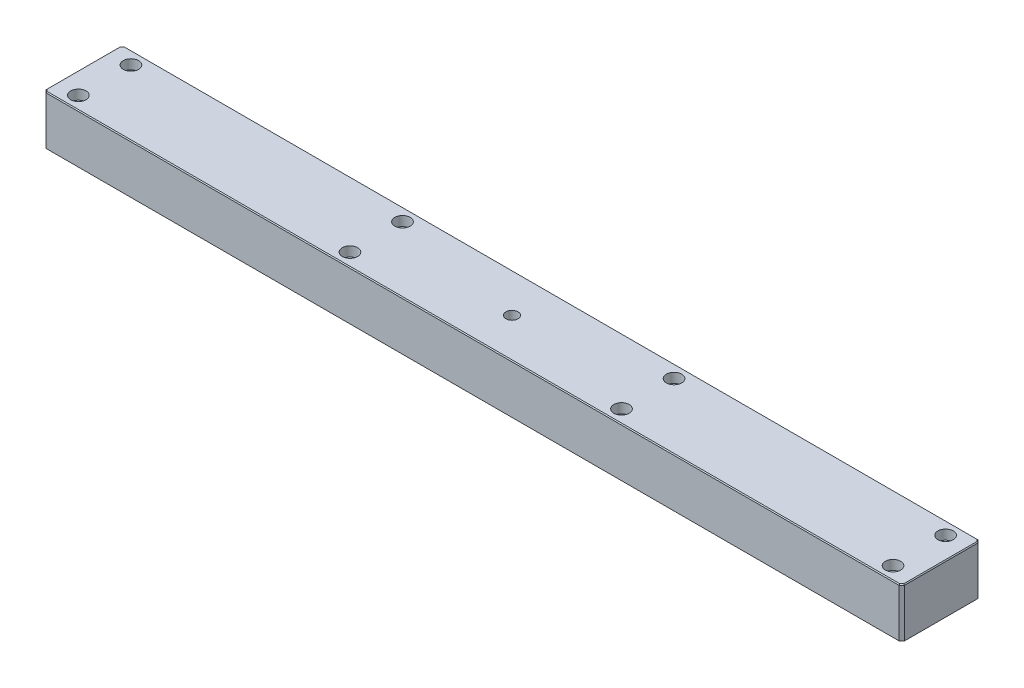
from build123d import *

# Parameters (mm, degrees)
SKETCH_1_W               = 980
SKETCH_1_H               = 90
EXTRUDE_1_DEPTH          = 56
CHAMFER_1_SIZE           = 3
CHAMFER_2_SIZE           = 1
CUT_EXTRUDE_1_DEPTH      = 496.238326465
CUT_EXTRUDE_1_DEPTH_BACK = 496.238326465
SKETCH_2_R               = 5.5
SKETCH_4_R               = 8.75
CUT_EXTRUDE_2_DEPTH      = 11
SKETCH_5_R               = 6.9175
CUT_EXTRUDE_3_DEPTH      = 25


with BuildPart() as part:
    # ｽｹｯﾁ1 → ﾎﾞｽ - 押し出し1 (new body)
    with BuildSketch(Plane(origin=(0, 0, 0), x_dir=(1, 0, 0), z_dir=(0, 1, 0))):
        Rectangle(SKETCH_1_W, SKETCH_1_H)
    extrude(amount=EXTRUDE_1_DEPTH)

    # 面取り1
    chamfer_1_edges = [part.edges().sort_by_distance(p)[0] for p in [
        (-490, 28, -45),
        (490, 28, -45),
        (490, 28, 45),
        (-490, 28, 45),
    ]]
    chamfer(chamfer_1_edges, length=CHAMFER_1_SIZE)

    # 面取り2
    chamfer_2_edges = [part.edges().sort_by_distance(p)[0] for p in [
        (-490, 56, 0),
        (0, 56, -45),
        (0, 56, 45),
        (490, 56, 0),
        (-488.5, 56, 43.5),
        (488.5, 56, 43.5),
        (488.5, 56, -43.5),
        (-488.5, 56, -43.5),
    ]]
    chamfer(chamfer_2_edges, length=CHAMFER_2_SIZE)

    # ｽｹｯﾁ2 → ｶｯﾄ - 押し出し1 (cut, two sides: drawn at the far end of the back side and taken through both)
    with BuildSketch(Plane(origin=(0, 0, 0), x_dir=(1, 0, 0), z_dir=(0, 1, 0)).offset(-CUT_EXTRUDE_1_DEPTH_BACK)):
        with Locations(Location((-155, -30, 0), (0, 0, 270))):
            Circle(SKETCH_2_R)
        with Locations(Location((-155, 30, 0), (0, 0, 270))):
            Circle(SKETCH_2_R)
        with Locations(Location((-465, -30, 0), (0, 0, 270))):
            Circle(SKETCH_2_R)
        with Locations(Location((-465, 30, 0), (0, 0, 270))):
            Circle(SKETCH_2_R)
        with Locations(Location((155, -30, 0), (0, 0, 270))):
            Circle(SKETCH_2_R)
        with Locations(Location((155, 30, 0), (0, 0, 270))):
            Circle(SKETCH_2_R)
        with Locations(Location((465, -30, 0), (0, 0, 270))):
            Circle(SKETCH_2_R)
        with Locations(Location((465, 30, 0), (0, 0, 270))):
            Circle(SKETCH_2_R)
    extrude(amount=CUT_EXTRUDE_1_DEPTH + CUT_EXTRUDE_1_DEPTH_BACK, mode=Mode.SUBTRACT)

    # ｽｹｯﾁ4 → ｶｯﾄ - 押し出し2 (cut)
    with BuildSketch(Plane(origin=(0, 56, 0), x_dir=(1, 0, 0), z_dir=(0, 1, 0))):
        with Locations(Location((-155, -30, 0), (0, 0, 270))):
            Circle(SKETCH_4_R)
        with Locations(Location((-155, 30, 0), (0, 0, 270))):
            Circle(SKETCH_4_R)
        with Locations(Location((-465, -30, 0), (0, 0, 270))):
            Circle(SKETCH_4_R)
        with Locations(Location((-465, 30, 0), (0, 0, 270))):
            Circle(SKETCH_4_R)
        with Locations(Location((155, -30, 0), (0, 0, 270))):
            Circle(SKETCH_4_R)
        with Locations(Location((155, 30, 0), (0, 0, 270))):
            Circle(SKETCH_4_R)
        with Locations(Location((465, -30, 0), (0, 0, 270))):
            Circle(SKETCH_4_R)
        with Locations(Location((465, 30, 0), (0, 0, 270))):
            Circle(SKETCH_4_R)
    extrude(amount=-CUT_EXTRUDE_2_DEPTH, mode=Mode.SUBTRACT)

    # ｽｹｯﾁ5 → ｶｯﾄ - 押し出し3 (cut)
    with BuildSketch(Plane(origin=(0, 56, 0), x_dir=(1, 0, 0), z_dir=(0, 1, 0))):
        with Locations(Location((0, 0, 0), (0, 0, 270))):
            Circle(SKETCH_5_R)
    extrude(amount=-CUT_EXTRUDE_3_DEPTH, mode=Mode.SUBTRACT)


solid = part.part
